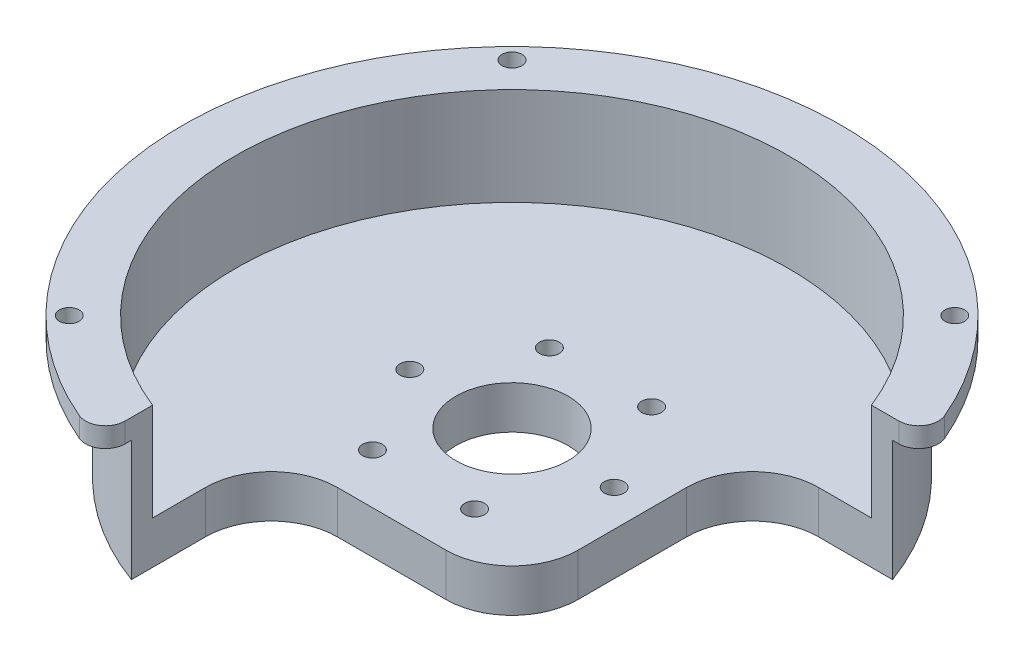
from build123d import *

# Parameters (mm, degrees)
SKETCH1_R           = 8.5
SKETCH1_R_2         = 1.5
BOSS_EXTRUDE1_DEPTH = 6.5
BOSS_EXTRUDE3_DEPTH = 14.82
BOSS_EXTRUDE4_START = -3
SKETCH4_R           = 1.5
BOSS_EXTRUDE4_DEPTH = 3


with BuildPart() as part:
    # Sketch1 → Boss-Extrude1 (new body)
    with BuildSketch(Plane(origin=(0, 0, 0), x_dir=(1, 0, 0), z_dir=(0, 1, 0))):
        with BuildLine():
            Line((-15.5, -31), (-15.5, -42.246301613))
            ThreePointArc((-15.5, -42.246301613), (-31.819805153, 31.819805153), (42.246301613, 15.5))
            Line((42.246301613, 15.5), (31, 15.5))
            ThreePointArc((31, 15.5), (23.928932188, 12.571067812), (21, 5.5))
            Line((21, 5.5), (21, -11))
            ThreePointArc((21, -11), (18.071067812, -18.071067812), (11, -21))
            Line((11, -21), (-5.5, -21))
            ThreePointArc((-5.5, -21), (-12.571067812, -23.928932188), (-15.5, -31))
        make_face()
        with Locations(Location((0, 0, 0), (0, 0, 90))):
            Circle(SKETCH1_R, mode=Mode.SUBTRACT)
        with Locations(Location((-7.75, 13.423393759, 0), (0, 0, 90))):
            Circle(SKETCH1_R_2, mode=Mode.SUBTRACT)
        with Locations(Location((7.75, 13.423393759, 0), (0, 0, 90))):
            Circle(SKETCH1_R_2, mode=Mode.SUBTRACT)
        with Locations(Location((15.5, 0, 0), (0, 0, 90))):
            Circle(SKETCH1_R_2, mode=Mode.SUBTRACT)
        with Locations(Location((-15.5, 0, 0), (0, 0, 90))):
            Circle(SKETCH1_R_2, mode=Mode.SUBTRACT)
        with Locations(Location((-7.75, -13.423393759, 0), (0, 0, 90))):
            Circle(SKETCH1_R_2, mode=Mode.SUBTRACT)
        with Locations(Location((7.75, -13.423393759, 0), (0, 0, 90))):
            Circle(SKETCH1_R_2, mode=Mode.SUBTRACT)
    extrude(amount=BOSS_EXTRUDE1_DEPTH)

    # Sketch3 → Boss-Extrude3 (add)
    with BuildSketch(Plane(origin=(0, 6.5, 0), x_dir=(1, 0, 0), z_dir=(0, 1, 0))):
        with BuildLine():
            Line((42.246301613, 15.5), (39.035240489, 15.5))
            ThreePointArc((39.035240489, 15.5), (-29.69848481, 29.69848481), (-15.5, -39.035240489))
            Line((-15.5, -39.035240489), (-15.5, -42.246301613))
            ThreePointArc((-15.5, -42.246301613), (-31.819805153, 31.819805153), (42.246301613, 15.5))
        make_face()
    extrude(amount=BOSS_EXTRUDE3_DEPTH)

    # Sketch4 → Boss-Extrude4 (add)
    with BuildSketch(Plane(origin=(0, 21.32, 0), x_dir=(1, 0, 0), z_dir=(0, 1, 0)).offset(BOSS_EXTRUDE4_START)):
        with BuildLine():
            Line((42.246301613, 15.5), (43.205902375, 15.5))
            ThreePointArc((43.205902375, 15.5), (45.710154078, 16.848115196), (45.96372593, 19.680851064))
            ThreePointArc((45.96372593, 19.680851064), (-35.355339059, 35.355339059), (-19.680851064, -45.96372593))
            ThreePointArc((-19.680851064, -45.96372593), (-16.848115196, -45.710154078), (-15.5, -43.205902375))
            Line((-15.5, -43.205902375), (-15.5, -42.246301613))
            ThreePointArc((-15.5, -42.246301613), (-31.819805153, 31.819805153), (42.246301613, 15.5))
        make_face()
        with Locations(Location((-33.587572106, 33.587572106, 0), (0, 0, 270))):
            Circle(SKETCH4_R, mode=Mode.SUBTRACT)
        with Locations(Location((-33.587572106, -33.587572106, 0), (0, 0, 270))):
            Circle(SKETCH4_R, mode=Mode.SUBTRACT)
        with Locations(Location((33.587572106, 33.587572106, 0), (0, 0, 270))):
            Circle(SKETCH4_R, mode=Mode.SUBTRACT)
    extrude(amount=BOSS_EXTRUDE4_DEPTH)


solid = part.part
